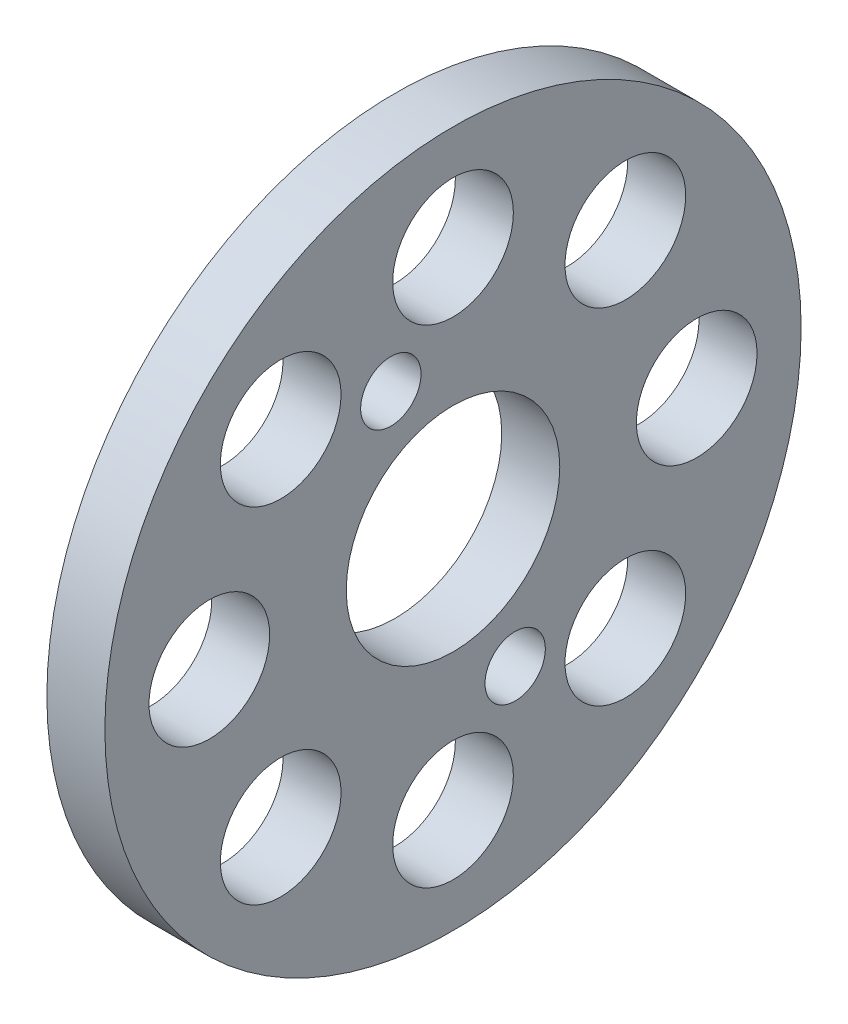
from build123d import *

# Parameters (mm, degrees)
AXIAL_PROFILE_MM_W     = 5
AXIAL_PROFILE_MM_H     = 20.8
AXIAL_HOLES_DEPTH      = 155.634051877
AXIAL_HOLES_DEPTH_BACK = 155.634051877
SKETCH2_R              = 5.2
SKETCH2_R_2            = 2.6


with BuildPart() as part:
    # Axial profile (mm) → Full revolution (revolve)
    with BuildSketch(Plane.XY, mode=Mode.PRIVATE) as full_revolution_sk:
        with Locations((146.2, 19.6)):
            Rectangle(AXIAL_PROFILE_MM_W, AXIAL_PROFILE_MM_H)
    revolve(full_revolution_sk.sketch.rotate(Axis((-110, 0, 0), (1, 0, 0)), 90), axis=Axis((-110, 0, 0), (1, 0, 0)))

    # Sketch2 → Axial holes (cut, two sides: drawn at the far end of the back side and taken through both)
    with BuildSketch(Plane(origin=(0, 0, 0), x_dir=(0, 0, -1), z_dir=(1, 0, 0)).offset(-AXIAL_HOLES_DEPTH_BACK)):
        with Locations((0, 21)):
            Circle(SKETCH2_R)
        with Locations((-14.849242405, 14.849242405)):
            Circle(SKETCH2_R)
        with Locations((-21, 0)):
            Circle(SKETCH2_R)
        with Locations((-14.849242405, -14.849242405)):
            Circle(SKETCH2_R)
        with Locations((0, -21)):
            Circle(SKETCH2_R)
        with Locations((14.849242405, -14.849242405)):
            Circle(SKETCH2_R)
        with Locations((21, 0)):
            Circle(SKETCH2_R)
        with Locations((14.849242405, 14.849242405)):
            Circle(SKETCH2_R)
        with Locations((-5.357568053, 12.934313455)):
            Circle(SKETCH2_R_2)
        with Locations((5.357568053, -12.934313455)):
            Circle(SKETCH2_R_2)
    extrude(amount=AXIAL_HOLES_DEPTH + AXIAL_HOLES_DEPTH_BACK, mode=Mode.SUBTRACT)


solid = part.part
